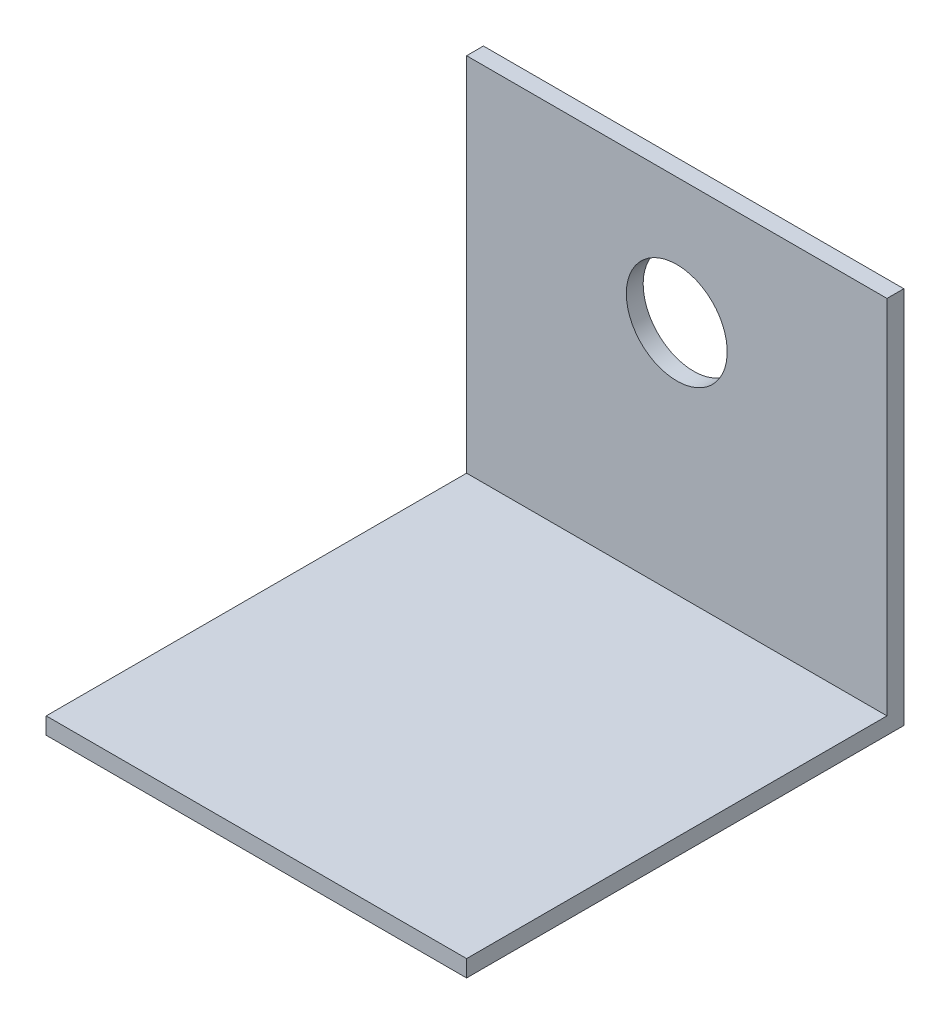
from build123d import *

# Parameters (mm, degrees)
SKETCH1_W           = 50
SKETCH1_H           = 50
BOSS_EXTRUDE1_DEPTH = 2
SKETCH2_W           = 50
SKETCH2_H           = 45
SKETCH2_R           = 6
BOSS_EXTRUDE2_DEPTH = 2


with BuildPart() as part:
    # Sketch1 → Boss-Extrude1 (new body)
    with BuildSketch(Plane(origin=(0, 0, 0), x_dir=(1, 0, 0), z_dir=(0, 1, 0))):
        with Locations((25, -25)):
            Rectangle(SKETCH1_W, SKETCH1_H)
    extrude(amount=BOSS_EXTRUDE1_DEPTH)

    # Sketch2 → Boss-Extrude2 (add)
    with BuildSketch(Plane(origin=(0, 0, 0), x_dir=(-1, 0, 0), z_dir=(0, 0, -1))):
        with Locations((-25, 22.5)):
            Rectangle(SKETCH2_W, SKETCH2_H)
        with Locations((-25, 30)):
            Circle(SKETCH2_R, mode=Mode.SUBTRACT)
    extrude(amount=BOSS_EXTRUDE2_DEPTH)


solid = part.part
